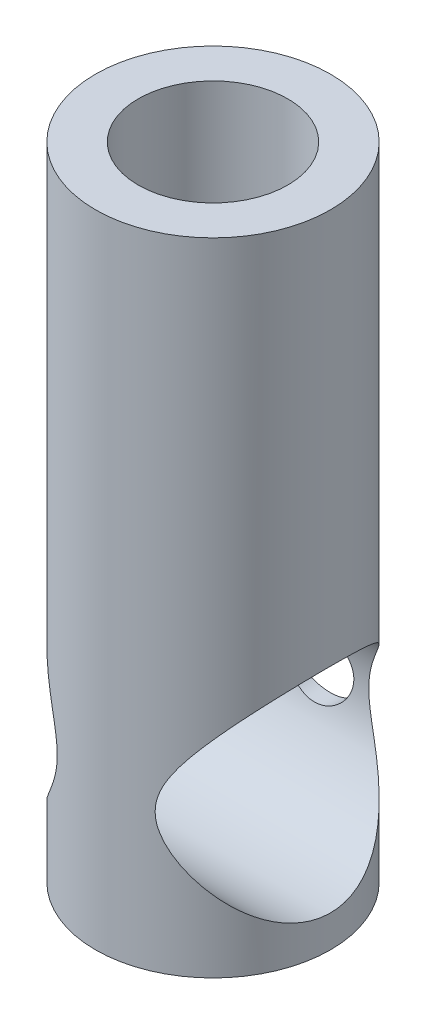
from build123d import *

# Parameters (mm, degrees)
SKETCH1_R               = 55
BOSS_EXTRUDE1_DEPTH     = 300
CUT_EXTRUDE2_DEPTH      = 310.919344346
CUT_EXTRUDE2_DEPTH_BACK = 310.919344346
SKETCH5_R               = 50
SKETCH9_R               = 35
CUT_EXTRUDE3_DEPTH      = 211
SKETCH10_R              = 15.915907465
CUT_EXTRUDE4_DEPTH      = 177


with BuildPart() as part:
    # Sketch1 → Boss-Extrude1 (new body)
    with BuildSketch(Plane(origin=(0, 0, 0), x_dir=(1, 0, 0), z_dir=(0, 1, 0))):
        with Locations(Location((0, 0, 0), (0, 0, 270))):
            Circle(SKETCH1_R)
    extrude(amount=BOSS_EXTRUDE1_DEPTH)

    # Sketch5 → Cut-Extrude2 (cut, two sides: drawn at the far end of the back side and taken through both)
    with BuildSketch(Plane(origin=(0, 0, 0), x_dir=(0, 0, -1), z_dir=(1, 0, 0)).offset(-CUT_EXTRUDE2_DEPTH_BACK)):
        with Locations((0, 65)):
            Circle(SKETCH5_R)
    extrude(amount=CUT_EXTRUDE2_DEPTH + CUT_EXTRUDE2_DEPTH_BACK, mode=Mode.SUBTRACT)

    # Sketch9 → Cut-Extrude3 (cut)
    with BuildSketch(Plane(origin=(0, 300, 0), x_dir=(1, 0, 0), z_dir=(0, 1, 0))):
        with Locations(Location((0, 0, 0), (0, 0, 270))):
            Circle(SKETCH9_R)
    extrude(amount=-CUT_EXTRUDE3_DEPTH, mode=Mode.SUBTRACT)

    # Sketch10 → Cut-Extrude4 (cut)
    with BuildSketch(Plane.XY):
        with Locations(Location((0, 65.184966797, 0), (0, 0, 359.334121801))):
            Circle(SKETCH10_R)
    extrude(amount=-CUT_EXTRUDE4_DEPTH, mode=Mode.SUBTRACT)


solid = part.part
